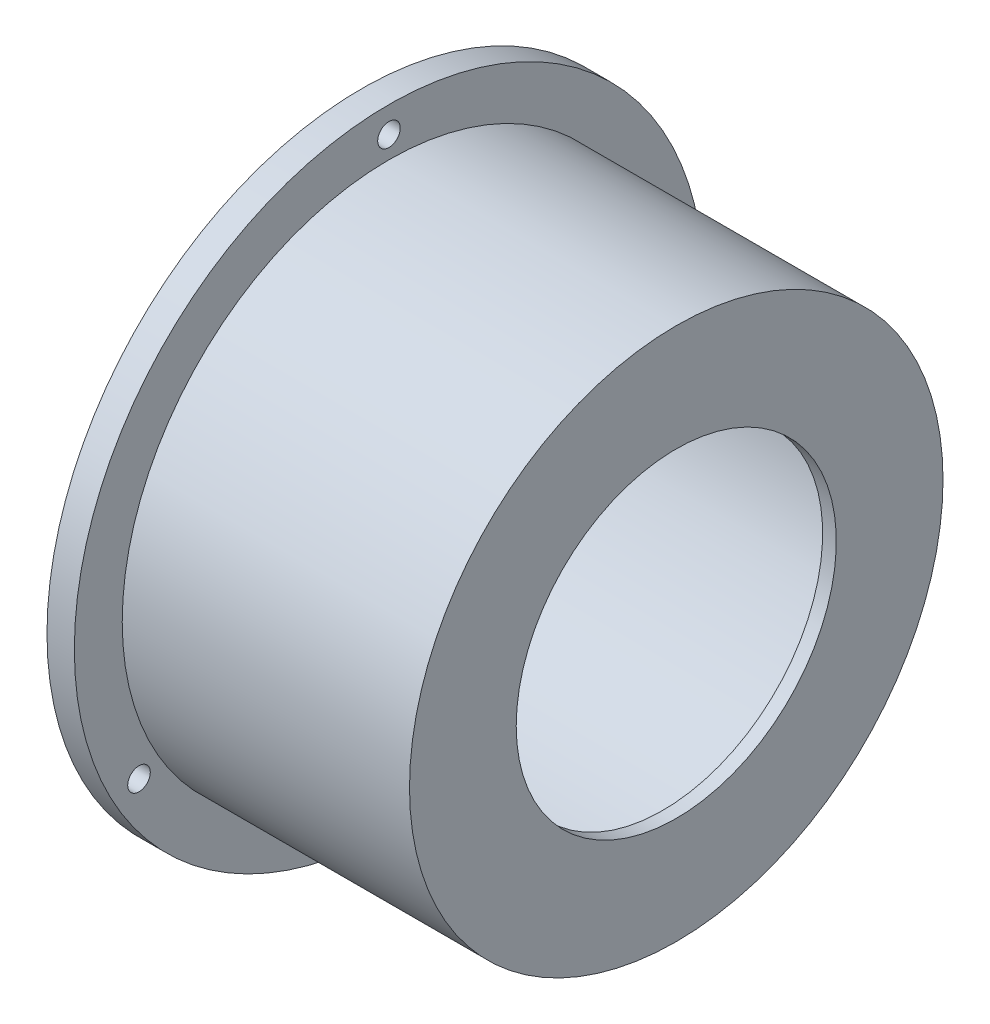
from build123d import *

# Parameters (mm, degrees)
AXIAL_HOLES_DEPTH      = 193.994533601
AXIAL_HOLES_DEPTH_BACK = 193.994533601
SKETCH2_R              = 1.65


with BuildPart() as part:
    # Axial profile (mm) → Full revolution (revolve)
    with BuildSketch(Plane.XY, mode=Mode.PRIVATE) as full_revolution_sk:
        Polygon((135.7, 36.4), (179.7, 36.4), (179.7, 23.4), (181.7, 23.4), (181.7, 39), (139.7, 39), (139.7, 46), (135.7, 46), align=None)
    revolve(full_revolution_sk.sketch.rotate(Axis((-110, 0, 0), (1, 0, 0)), 90), axis=Axis((-110, 0, 0), (1, 0, 0)))

    # Sketch2 → Axial holes (cut, two sides: drawn at the far end of the back side and taken through both)
    with BuildSketch(Plane(origin=(0, 0, 0), x_dir=(0, 0, -1), z_dir=(1, 0, 0)).offset(-AXIAL_HOLES_DEPTH_BACK)):
        with Locations(Location((0, 42.2, 0), (0, 0, 180))):
            Circle(SKETCH2_R)
        with Locations(Location((-36.54627204, -21.1, 0), (0, 0, 180))):
            Circle(SKETCH2_R)
        with Locations(Location((36.54627204, -21.1, 0), (0, 0, 180))):
            Circle(SKETCH2_R)
    extrude(amount=AXIAL_HOLES_DEPTH + AXIAL_HOLES_DEPTH_BACK, mode=Mode.SUBTRACT)


solid = part.part
